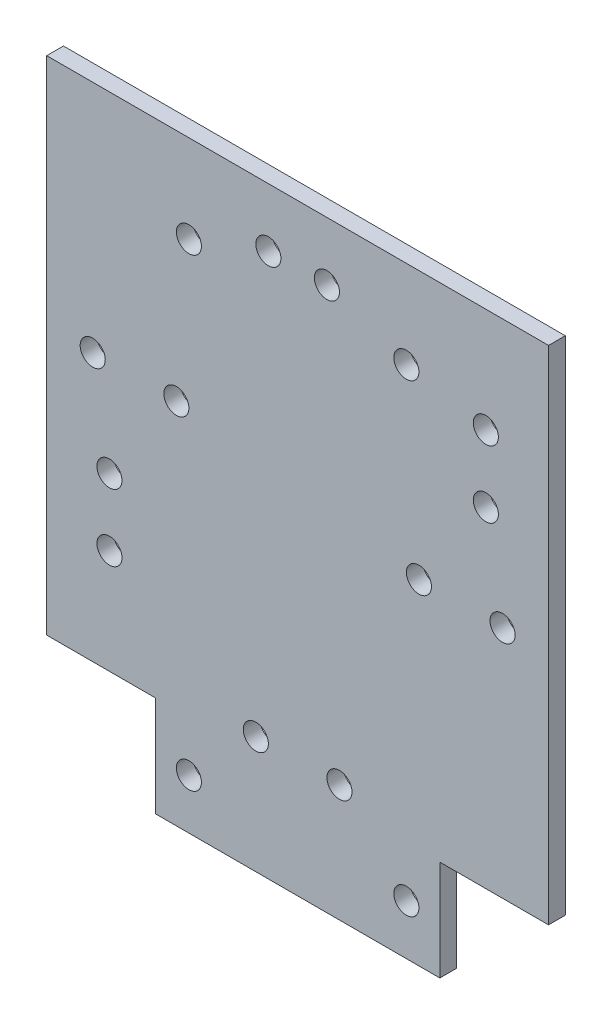
from build123d import *

# Parameters (mm, degrees)
ESQUISSE1_R      = 1.5
EXTRUSION1_DEPTH = 2


with BuildPart() as part:
    # Esquisse1 → Extrusion1 (new body)
    with BuildSketch(Plane.XY):
        Polygon((5.264207965, 14.044526316), (65.264207965, 14.044526316), (65.264207965, -45.955473684), (52.264207965, -45.955473684), (52.264207965, -57.955473684), (18.264207965, -57.955473684), (18.264207965, -45.955473684), (5.264207965, -45.955473684), align=None)
        with Locations((57.764207965, 1.544526316)):
            Circle(ESQUISSE1_R, mode=Mode.SUBTRACT)
        with Locations((57.764207965, -6.455473684)):
            Circle(ESQUISSE1_R, mode=Mode.SUBTRACT)
        with Locations((12.764207965, -33.455473684)):
            Circle(ESQUISSE1_R, mode=Mode.SUBTRACT)
        with Locations((12.764207965, -25.455473684)):
            Circle(ESQUISSE1_R, mode=Mode.SUBTRACT)
        with Locations((40.264207965, -43.955473684)):
            Circle(ESQUISSE1_R, mode=Mode.SUBTRACT)
        with Locations((30.264207965, -43.955473684)):
            Circle(ESQUISSE1_R, mode=Mode.SUBTRACT)
        with Locations((49.764207965, -17.955473684)):
            Circle(ESQUISSE1_R, mode=Mode.SUBTRACT)
        with Locations((59.764207965, -17.955473684)):
            Circle(ESQUISSE1_R, mode=Mode.SUBTRACT)
        with Locations((31.764207965, 7.044526316)):
            Circle(ESQUISSE1_R, mode=Mode.SUBTRACT)
        with Locations((38.764207965, 7.044526316)):
            Circle(ESQUISSE1_R, mode=Mode.SUBTRACT)
        with Locations((22.264207965, 3.544526316)):
            Circle(ESQUISSE1_R, mode=Mode.SUBTRACT)
        with Locations((48.264207965, 3.544526316)):
            Circle(ESQUISSE1_R, mode=Mode.SUBTRACT)
        with Locations((20.764207965, -13.955473684)):
            Circle(ESQUISSE1_R, mode=Mode.SUBTRACT)
        with Locations((10.764207965, -13.955473684)):
            Circle(ESQUISSE1_R, mode=Mode.SUBTRACT)
        with Locations((22.264207965, -51.955473684)):
            Circle(ESQUISSE1_R, mode=Mode.SUBTRACT)
        with Locations((48.264207965, -51.955473684)):
            Circle(ESQUISSE1_R, mode=Mode.SUBTRACT)
    extrude(amount=EXTRUSION1_DEPTH)


solid = part.part
